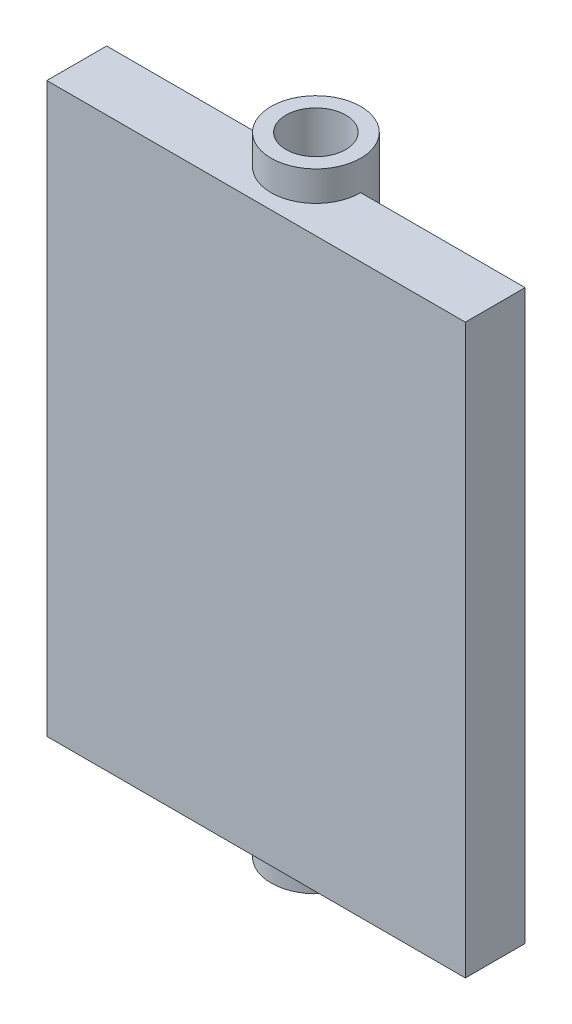
from build123d import *

# Parameters (mm, degrees)
SKETCH1_R           = 9.525
SKETCH1_R_2         = 6.35
BOSS_EXTRUDE1_DEPTH = 66.675
BOSS_EXTRUDE2_DEPTH = 60.325


with BuildPart() as part:
    # Sketch1 → Boss-Extrude1 (new, symmetric)
    with BuildSketch(Plane(origin=(0, 0, 0), x_dir=(1, 0, 0), z_dir=(0, 1, 0))):
        with Locations(Location((0, 0, 0), (0, 0, 270))):
            Circle(SKETCH1_R)
        with Locations(Location((0, 0, 0), (0, 0, 270))):
            Circle(SKETCH1_R_2, mode=Mode.SUBTRACT)
    extrude(amount=BOSS_EXTRUDE1_DEPTH, both=True)

    # Sketch2 → Boss-Extrude2 (add, symmetric)
    with BuildSketch(Plane(origin=(0, 0, 0), x_dir=(1, 0, 0), z_dir=(0, 1, 0))):
        with BuildLine():
            Line((9.525, 0), (44.45, 0))
            Line((44.45, 0), (44.45, -12.7))
            Line((44.45, -12.7), (-44.45, -12.7))
            Line((-44.45, -12.7), (-44.45, 0))
            Line((-44.45, 0), (-9.525, 0))
            ThreePointArc((-9.525, 0), (0, -9.525), (9.525, 0))
        make_face()
    extrude(amount=BOSS_EXTRUDE2_DEPTH, both=True)


solid = part.part
